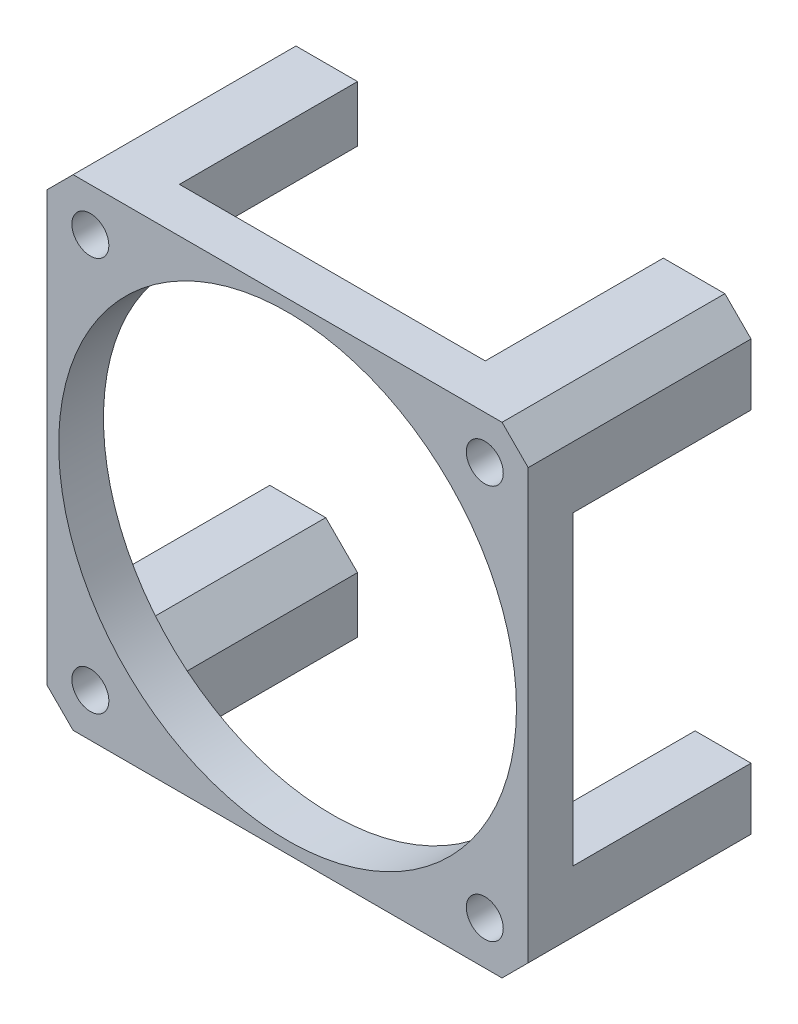
from build123d import *

# Parameters (mm, degrees)
SKETCH1_R           = 1.65
SKETCH1_R_2         = 20.45
SKETCH1_R_3         = 1.650080795
BOSS_EXTRUDE1_DEPTH = 4
BOSS_EXTRUDE2_START = -15.91
SKETCH1_4_R         = 1.65
SKETCH1_4_R_2       = 1.650080795
BOSS_EXTRUDE2_DEPTH = 15.91


with BuildPart() as part:
    # Sketch1 → Boss-Extrude1 (new body)
    with BuildSketch(Plane.XY):
        Polygon((19.162202379, -21.5), (21.5, -19.162202379), (21.5, 19.162202379), (19.162202379, 21.5), (-19.162202379, 21.5), (-21.5, 19.162202379), (-21.5, -19.162202379), (-19.162202379, -21.5), align=None)
        with Locations((17.621156877, -17.621156877)):
            Circle(SKETCH1_R, mode=Mode.SUBTRACT)
        Circle(SKETCH1_R_2, mode=Mode.SUBTRACT)
        with Locations((-17.621156877, -17.621156877)):
            Circle(SKETCH1_R_3, mode=Mode.SUBTRACT)
        with Locations((-17.621156877, 17.621156877)):
            Circle(SKETCH1_R, mode=Mode.SUBTRACT)
        with Locations((17.621156877, 17.621156877)):
            Circle(SKETCH1_R, mode=Mode.SUBTRACT)
    extrude(amount=BOSS_EXTRUDE1_DEPTH)

    # Sketch1<4> → Boss-Extrude2 (add)
    # profile 1 of 4: a face of its own
    with BuildSketch(Plane.XY.offset(BOSS_EXTRUDE2_START)):
        Polygon((13.662202379, -21.5), (19.162202379, -21.5), (21.5, -19.162202379), (21.5, -13.662202379), (16.5, -13.662202379), (13.662202379, -16.5), align=None)
        with Locations((17.621156877, -17.621156877)):
            Circle(SKETCH1_4_R, mode=Mode.SUBTRACT)
    # profile 2 of 4: a face of its own
    with BuildSketch(Plane.XY.offset(BOSS_EXTRUDE2_START)):
        Polygon((-19.162202379, -21.5), (-13.662202379, -21.5), (-13.662202379, -16.5), (-16.5, -13.662202379), (-21.5, -13.662202379), (-21.5, -19.162202379), align=None)
        with Locations((-17.621156877, -17.621156877)):
            Circle(SKETCH1_4_R_2, mode=Mode.SUBTRACT)
    # profile 3 of 4: a face of its own
    with BuildSketch(Plane.XY.offset(BOSS_EXTRUDE2_START)):
        Polygon((16.5, 13.662202379), (21.5, 13.662202379), (21.5, 19.162202379), (19.162202379, 21.5), (13.662202379, 21.5), (13.662202379, 16.5), align=None)
        with Locations((17.621156877, 17.621156877)):
            Circle(SKETCH1_4_R, mode=Mode.SUBTRACT)
    # profile 4 of 4: a face of its own
    with BuildSketch(Plane.XY.offset(BOSS_EXTRUDE2_START)):
        Polygon((-21.5, 19.162202379), (-21.5, 13.662202379), (-16.5, 13.662202379), (-13.662202379, 16.5), (-13.662202379, 21.5), (-19.162202379, 21.5), align=None)
        with Locations((-17.621156877, 17.621156877)):
            Circle(SKETCH1_4_R, mode=Mode.SUBTRACT)
    extrude(amount=BOSS_EXTRUDE2_DEPTH)


solid = part.part
